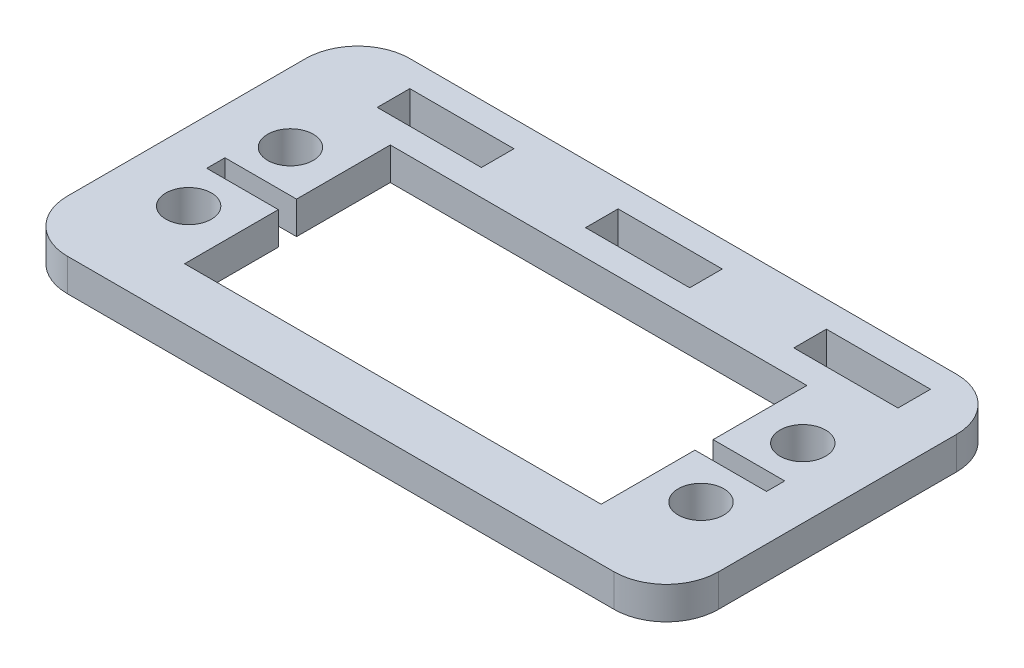
from build123d import *

# Parameters (mm, degrees)
SKETCH1_W            = 63.5
SKETCH1_H            = 33.401
SKETCH1_W_2          = 10.16
SKETCH1_H_2          = 3.175
SKETCH1_W_3          = 40.64
SKETCH1_H_3          = 20.066
MAIN_EXTRUSION_DEPTH = 3.175
SKETCH3_R            = 2.2225
MOUNTING_HOLES_DEPTH = 37.777630008
TAB_CUTOUT_DEPTH     = 37.777630008
FILLET1_R            = 5.08


with BuildPart() as part:
    # Sketch1 → Main Extrusion (new body)
    with BuildSketch(Plane(origin=(0, 0, 0), x_dir=(1, 0, 0), z_dir=(0, 1, 0))):
        with Locations((0, 1.5875)):
            Rectangle(SKETCH1_W, SKETCH1_H)
        with Locations((21.59, 14.1605)):
            Rectangle(SKETCH1_W_2, SKETCH1_H_2, mode=Mode.SUBTRACT)
        with Locations((1.27, 14.1605)):
            Rectangle(SKETCH1_W_2, SKETCH1_H_2, mode=Mode.SUBTRACT)
        with Locations((-19.05, 14.1605)):
            Rectangle(SKETCH1_W_2, SKETCH1_H_2, mode=Mode.SUBTRACT)
        Rectangle(SKETCH1_W_3, SKETCH1_H_3, mode=Mode.SUBTRACT)
    extrude(amount=MAIN_EXTRUSION_DEPTH)

    # Sketch3 → Mounting Holes (cut, through all)
    with BuildSketch(Plane(origin=(0, 3.175, 0), x_dir=(1, 0, 0), z_dir=(0, 1, 0))):
        with Locations(Location((-24.992246486, 4.9657, 0), (0, 0, 270))):
            Circle(SKETCH3_R)
        with Locations(Location((-24.992246486, -4.9657, 0), (0, 0, 270))):
            Circle(SKETCH3_R)
        with Locations(Location((24.992246486, -4.9657, 0), (0, 0, 90))):
            Circle(SKETCH3_R)
        with Locations(Location((24.992246486, 4.9657, 0), (0, 0, 90))):
            Circle(SKETCH3_R)
    extrude(amount=-MOUNTING_HOLES_DEPTH, mode=Mode.SUBTRACT)

    # Sketch5 → Tab cutout (cut, through all)
    with BuildSketch(Plane(origin=(0, 3.175, 0), x_dir=(1, 0, 0), z_dir=(0, 1, 0))):
        Polygon((-20.32, 0), (-20.32, 0.889), (-27.305, 0.889), (-27.305, -0.889), (-20.32, -0.889), align=None)
        Polygon((27.305, -0.889), (20.32, -0.889), (20.32, 0), (20.32, 0.889), (27.305, 0.889), align=None)
    extrude(amount=-TAB_CUTOUT_DEPTH, mode=Mode.SUBTRACT)

    # Fillet1
    fillet1_edges = [part.edges().sort_by_distance(p)[0] for p in [
        (31.75, 1.5875, 15.113),
        (-31.75, 1.5875, 15.113),
        (-31.75, 1.5875, -18.288),
        (31.75, 1.5875, -18.288),
    ]]
    fillet(fillet1_edges, radius=FILLET1_R)


solid = part.part
